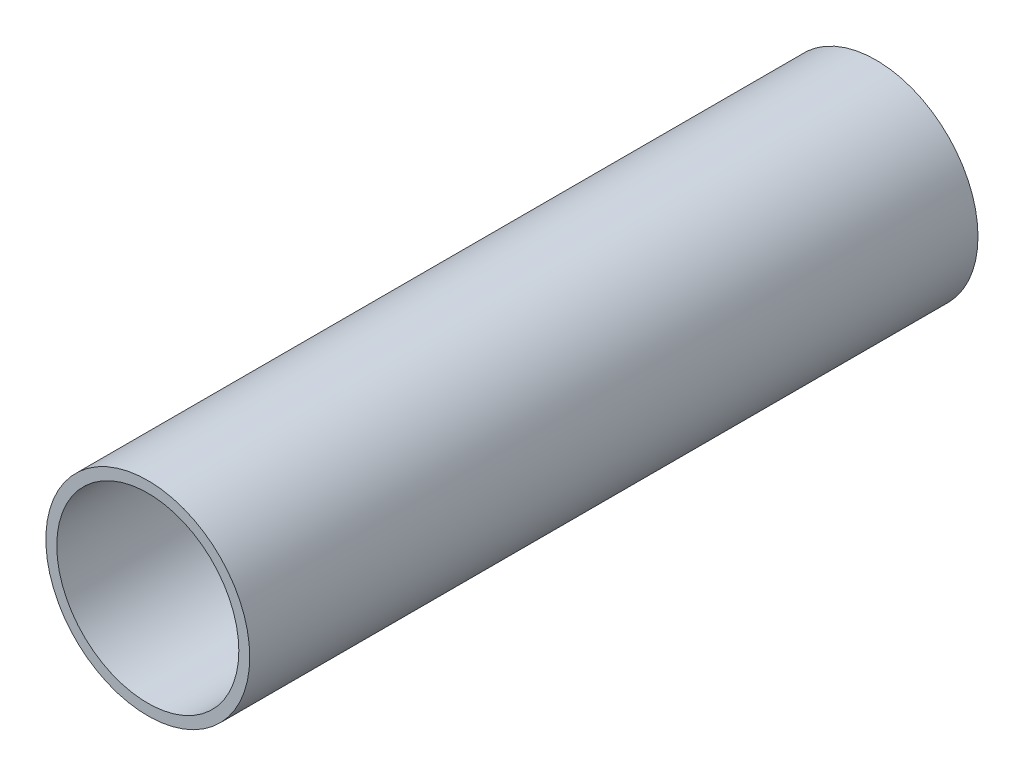
from build123d import *

# Parameters (mm, degrees)
SKETCH1_R           = 35.56
SKETCH1_R_2         = 31.75
BOSS_EXTRUDE1_DEPTH = 254


with BuildPart() as part:
    # Sketch1 → Boss-Extrude1 (new body)
    with BuildSketch(Plane.XY):
        Circle(SKETCH1_R)
        Circle(SKETCH1_R_2, mode=Mode.SUBTRACT)
    extrude(amount=BOSS_EXTRUDE1_DEPTH)


solid = part.part
